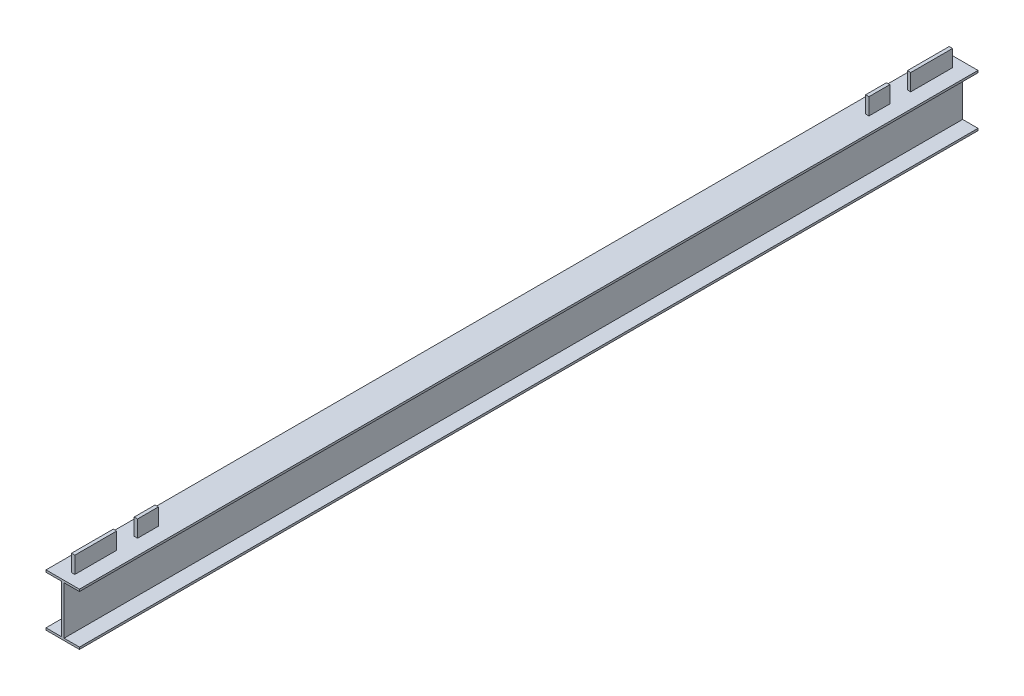
from build123d import *

# Parameters (mm, degrees)
SKETCH_2_W          = 160
SKETCH_2_H          = 250
EXTRUDE_1_DEPTH     = 4300
SKETCH_3_W          = 73.5
SKETCH_3_H          = 230
CUT_EXTRUDE_1_DEPTH = 4311.232012317
SKETCH_4_W          = 16
SKETCH_4_H          = 200
SKETCH_4_H_2        = 100
EXTRUDE_2_DEPTH     = 80


with BuildPart() as part:
    # 草图2 → 凸台-拉伸1 (new body)
    with BuildSketch(Plane.XY):
        with Locations((80, 125)):
            Rectangle(SKETCH_2_W, SKETCH_2_H)
    extrude(amount=EXTRUDE_1_DEPTH)

    # 草图3 → 切除-拉伸1 (cut, through all)
    with BuildSketch(Plane.XY.offset(4300)):
        with Locations((123.25, 125)):
            Rectangle(SKETCH_3_W, SKETCH_3_H)
        with Locations((36.75, 125)):
            Rectangle(SKETCH_3_W, SKETCH_3_H)
    extrude(amount=-CUT_EXTRUDE_1_DEPTH, mode=Mode.SUBTRACT)

    # 草图4 → 凸台-拉伸2 (add)
    with BuildSketch(Plane(origin=(0, 250, 0), x_dir=(1, 0, 0), z_dir=(0, 1, 0))):
        with Locations((80, -150)):
            Rectangle(SKETCH_4_W, SKETCH_4_H)
        with Locations((80, -400)):
            Rectangle(SKETCH_4_W, SKETCH_4_H_2)
        with Locations((80, -4150)):
            Rectangle(SKETCH_4_W, SKETCH_4_H)
        with Locations((80, -3900)):
            Rectangle(SKETCH_4_W, SKETCH_4_H_2)
    extrude(amount=EXTRUDE_2_DEPTH)


solid = part.part
